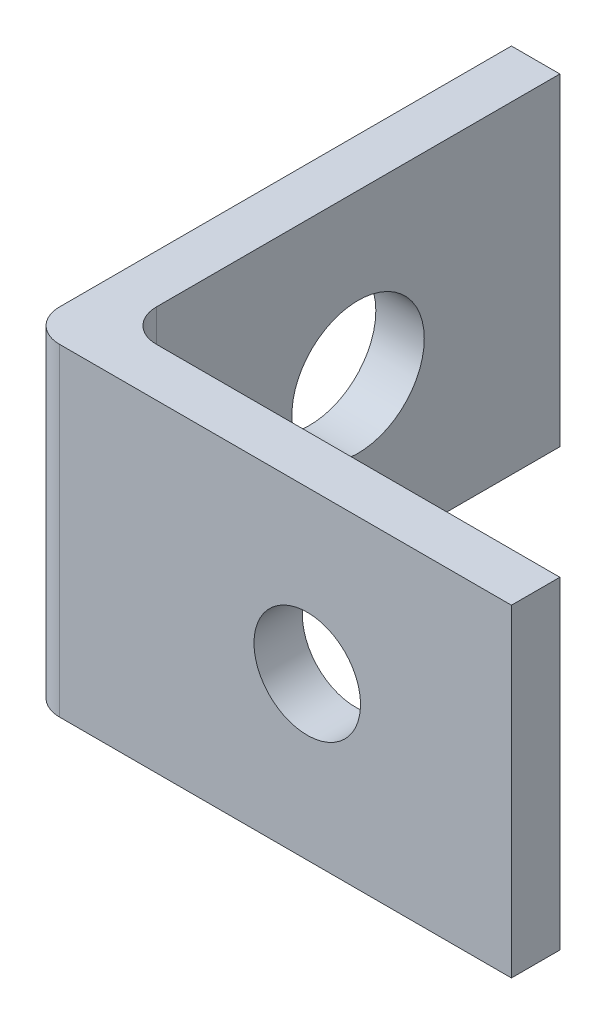
from build123d import *

# Parameters (mm, degrees)
EXTRUDE_1_DEPTH     = 10
CUT_EXTRUDE_3_DEPTH = 8
SKETCH_12_R         = 2.05
CUT_EXTRUDE_5_DEPTH = 95


with BuildPart() as part:
    # Эскиз1 → Бобышка-Вытянуть1 (new body)
    with BuildSketch(Plane(origin=(0, 0, 0), x_dir=(1, 0, 0), z_dir=(0, 1, 0))):
        with BuildLine():
            Line((0, 1), (0, 15))
            Line((0, 15), (1.5, 15))
            Line((1.5, 15), (1.5, 2.5))
            ThreePointArc((1.5, 2.5), (1.792893219, 1.792893219), (2.5, 1.5))
            Line((2.5, 1.5), (15, 1.5))
            Line((15, 1.5), (15, 0))
            Line((15, 0), (1, 0))
            ThreePointArc((1, 0), (0.292893219, 0.292893219), (0, 1))
        make_face()
    extrude(amount=EXTRUDE_1_DEPTH)

    # Эскиз6 → Вырез-Вытянуть3 (cut)
    with BuildSketch(Plane(origin=(-307.940790238, -349.204468703, -1.5), x_dir=(-0.9998892265297747, 0.014884040771535371, 0), z_dir=(0, 0, -1))):
        with BuildLine():
            ThreePointArc((-309.659295343, 358.877763083), (-310.142569154, 360.044489272), (-311.309295343, 360.527763083))
            Line((-311.309295343, 360.527763083), (-311.309295343, 357.227763083))
            ThreePointArc((-311.309295343, 357.227763083), (-310.142569154, 357.711036894), (-309.659295343, 358.877763083))
        make_face()
        with BuildLine():
            Line((-311.309295343, 357.227763083), (-311.309295343, 360.527763083))
            ThreePointArc((-311.309295343, 360.527763083), (-312.959295343, 358.877763083), (-311.309295343, 357.227763083))
        make_face()
    extrude(amount=-CUT_EXTRUDE_3_DEPTH, mode=Mode.SUBTRACT)

    # Эскиз12 → Вырез-Вытянуть5 (cut)
    with BuildSketch(Plane(origin=(1.5, 0, 0), x_dir=(0, 0, -1), z_dir=(1, 0, 0))):
        with Locations((8.75, 5)):
            Circle(SKETCH_12_R)
    extrude(amount=-CUT_EXTRUDE_5_DEPTH, mode=Mode.SUBTRACT)


solid = part.part
